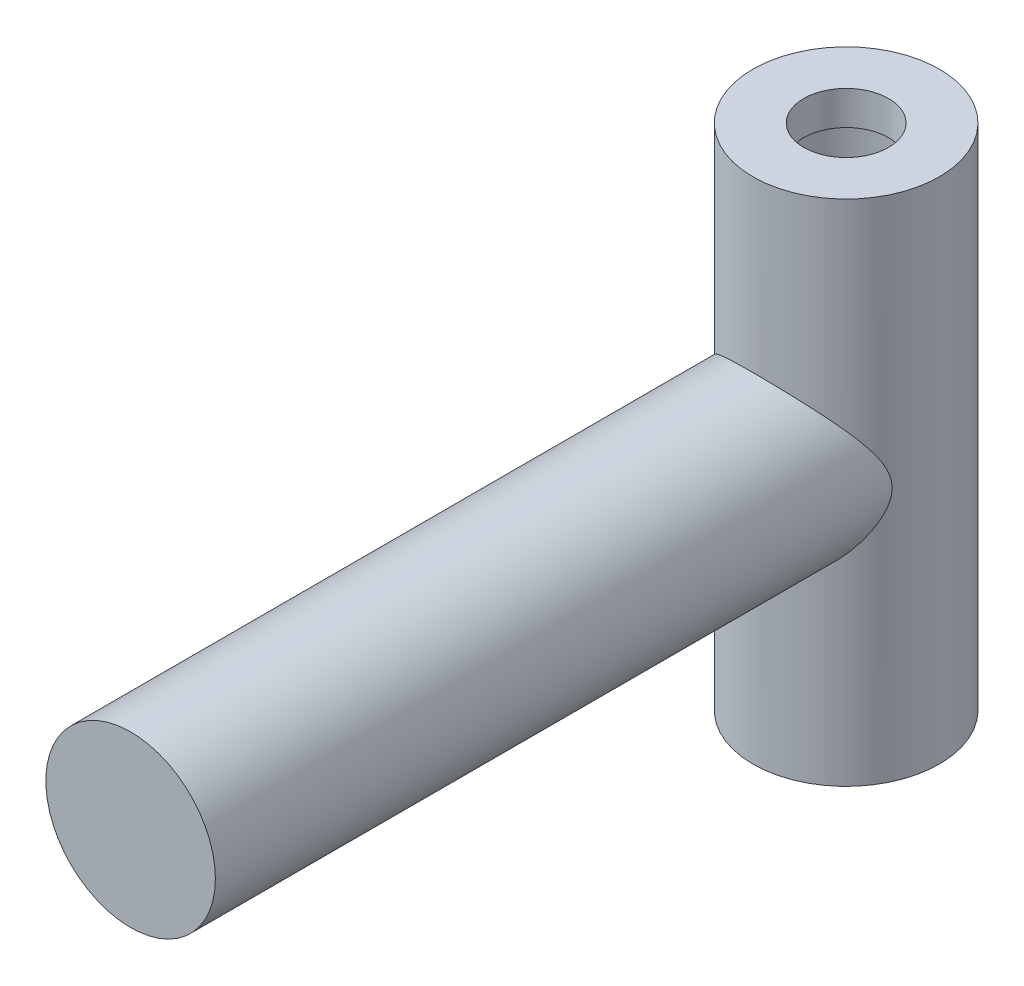
from build123d import *

# Parameters (mm, degrees)
CROQUIS1_R              = 5
SALIENTE_EXTRUIR1_DEPTH = 40
CROQUIS2_R              = 5.5
CROQUIS2_R_2            = 3.75
SALIENTE_EXTRUIR2_DEPTH = 15
CORTAR_EXTRUIR1_START   = -30
CROQUIS3_R              = 3.75
CORTAR_EXTRUIR1_DEPTH   = 30
CROQUIS4_R              = 5.5
CROQUIS4_R_2            = 2.5
SALIENTE_EXTRUIR3_DEPTH = 2


with BuildPart() as part:
    # Croquis1 → Saliente-Extruir1 (new body)
    with BuildSketch(Plane.XY):
        Circle(CROQUIS1_R)
    extrude(amount=-SALIENTE_EXTRUIR1_DEPTH)

    # Croquis2 → Saliente-Extruir2 (add, symmetric)
    with BuildSketch(Plane(origin=(0, 0, 0), x_dir=(1, 0, 0), z_dir=(0, 1, 0))):
        with Locations(Location((0, 42.202107472, 0), (0, 0, 270))):
            Circle(CROQUIS2_R)
        with Locations(Location((0, 42.202107472, 0), (0, 0, 270))):
            Circle(CROQUIS2_R_2, mode=Mode.SUBTRACT)
    extrude(amount=SALIENTE_EXTRUIR2_DEPTH, both=True)

    # Croquis3 → Cortar-Extruir1 (cut)
    with BuildSketch(Plane(origin=(0, 15, 0), x_dir=(1, 0, 0), z_dir=(0, 1, 0)).offset(CORTAR_EXTRUIR1_START)):
        with Locations(Location((0, 42.202107472, 0), (0, 0, 270))):
            Circle(CROQUIS3_R)
    extrude(amount=CORTAR_EXTRUIR1_DEPTH, mode=Mode.SUBTRACT)

    # Croquis4 → Saliente-Extruir3 (add)
    with BuildSketch(Plane(origin=(0, 15, 0), x_dir=(1, 0, 0), z_dir=(0, 1, 0))):
        with Locations(Location((0, 42.202107472, 0), (0, 0, 270))):
            Circle(CROQUIS4_R)
        with Locations(Location((0, 42.202107472, 0), (0, 0, 270))):
            Circle(CROQUIS4_R_2, mode=Mode.SUBTRACT)
    saliente_extruir3 = extrude(amount=-SALIENTE_EXTRUIR3_DEPTH)

    # Simetría1: Saliente-Extruir3 across plane
    add(saliente_extruir3.mirror(Plane.ZX))


solid = part.part
